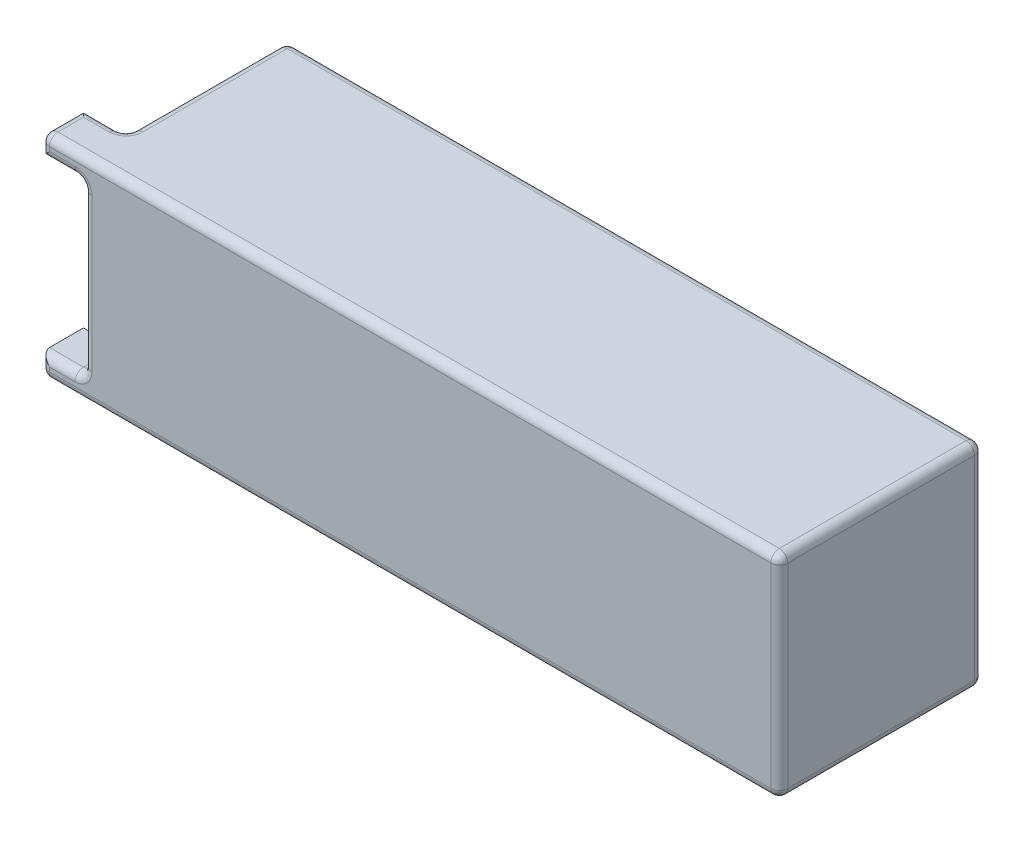
from build123d import *

# Parameters (mm, degrees)
SKETCH1_W           = 164
SKETCH1_H           = 50
BOSS_EXTRUDE1_DEPTH = 48
SKETCH2_W           = 10
SKETCH2_H           = 5
BOSS_EXTRUDE2_DEPTH = 10
FILLET1_R           = 2


with BuildPart() as part:
    # Sketch1 → Boss-Extrude1 (new body)
    with BuildSketch(Plane.XY):
        Rectangle(SKETCH1_W, SKETCH1_H)
    extrude(amount=BOSS_EXTRUDE1_DEPTH)

    # Sketch2 → Boss-Extrude2 (add)
    with BuildSketch(Plane.ZY.offset(82)):
        with Locations((43, -22.5)):
            Rectangle(SKETCH2_W, SKETCH2_H)
        with Locations((43, 22.5)):
            Rectangle(SKETCH2_W, SKETCH2_H)
    extrude(amount=BOSS_EXTRUDE2_DEPTH)

    # Fillet1
    fillet1_edges = [part.edges().sort_by_distance(p)[0] for p in [
        (-82, 0, 48),
        (-82, 25, 19),
        (-82, 22.5, 38),
        (-87, 25, 38),
        (-5, -25, 48),
        (-82, 20, 43),
        (-87, 20, 48),
        (-92, 25, 43),
        (-92, 22.5, 48),
        (-82, -25, 19),
        (-82, -20, 43),
        (-87, -20, 48),
        (-82, -22.5, 38),
        (-87, -25, 38),
        (-92, -22.5, 48),
        (-92, -25, 43),
        (82, 0, 48),
        (0, -25, 0),
        (-82, 0, 0),
        (0, 25, 0),
        (82, 0, 0),
        (82, -25, 24),
        (82, 25, 24),
        (-5, 25, 48),
    ]]
    fillet(fillet1_edges, radius=FILLET1_R)


solid = part.part
